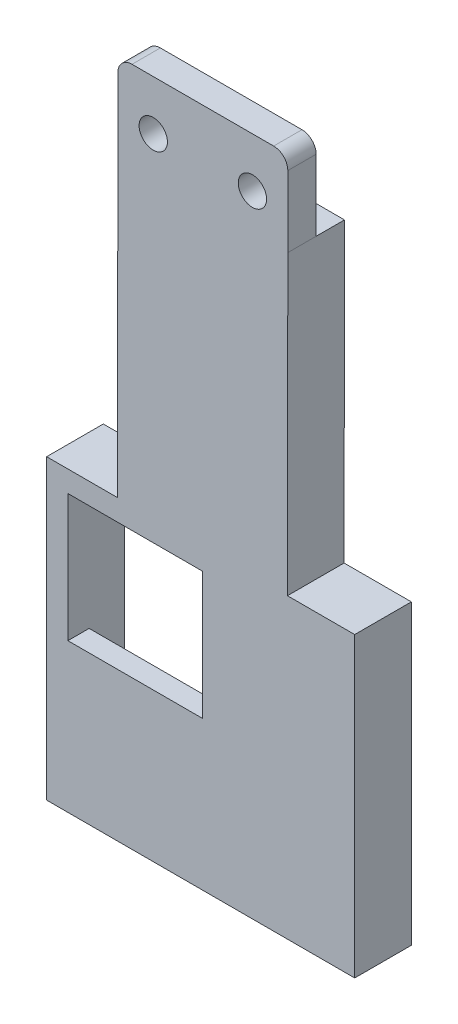
from build123d import *

# Parameters (mm, degrees)
SKETCH_1_R      = 2
EXTRUDE_1_DEPTH = 4
SKETCH_2_W      = 24.000018158
SKETCH_2_H      = 8
EXTRUDE_2_DEPTH = 45
EXTRUDE_START   = -3
EXTRUDE_3_DEPTH = 5
SKETCH_4_W      = 43.5
SKETCH_4_H      = 42
SKETCH_4_W_2    = 19
SKETCH_4_H_2    = 18
EXTRUDE_4_DEPTH = 3


with BuildPart() as part:
    # 草图1 → 凸台-拉伸1 (new body)
    with BuildSketch(Plane.XY):
        with BuildLine():
            Line((49.58322575, -24.029522484), (49.58322575, -14))
            ThreePointArc((49.58322575, -14), (48.997439312, -12.585786438), (47.58322575, -12))
            Line((47.58322575, -12), (27.58322575, -12))
            ThreePointArc((27.58322575, -12), (26.169012187, -12.585786438), (25.58322575, -14))
            Line((25.58322575, -14), (25.58322575, -24))
            Line((25.58322575, -24), (49.58322575, -24.029522484))
        make_face()
        with Locations((30.58322575, -19)):
            Circle(SKETCH_1_R, mode=Mode.SUBTRACT)
        with Locations((44.58322575, -19)):
            Circle(SKETCH_1_R, mode=Mode.SUBTRACT)
    extrude(amount=EXTRUDE_1_DEPTH)

    # 草图2 → 凸台-拉伸2 (add)
    with BuildSketch(Plane(origin=(-0.029483728, -23.968493717, 0), x_dir=(0.9999992434235635, -0.0012301025569531234, 0), z_dir=(-0.0012301025569531234, -0.9999992434235636, 0))):
        with Locations((37.612737934, 0)):
            Rectangle(SKETCH_2_W, SKETCH_2_H)
    extrude(amount=EXTRUDE_2_DEPTH)

    # 草图3 → 凸台-拉伸3 (add)
    with BuildSketch(Plane.XY.offset(4).offset(EXTRUDE_START)):
        Polygon((37.527871134, -66.014727196), (15.527871134, -66.014727196), (15.527871134, -108.014727196), (37.027871134, -108.014727196), (59.027871134, -108.014727196), (59.027871134, -66.014727196), align=None)
        Polygon((37.527871134, -69.014727196), (18.527871134, -69.014727196), (18.527871134, -105.014727196), (37.027871134, -105.014727196), (56.027871134, -105.014727196), (56.027871134, -69.014727196), align=None, mode=Mode.SUBTRACT)
    extrude(amount=-EXTRUDE_3_DEPTH)

    # 草图4 → 凸台-拉伸4 (add)
    with BuildSketch(Plane.XY.offset(1)):
        with Locations((37.277871134, -87.014727196)):
            Rectangle(SKETCH_4_W, SKETCH_4_H)
        with Locations((28.027871134, -78.014727196)):
            Rectangle(SKETCH_4_W_2, SKETCH_4_H_2, mode=Mode.SUBTRACT)
    extrude(amount=EXTRUDE_4_DEPTH)


solid = part.part
